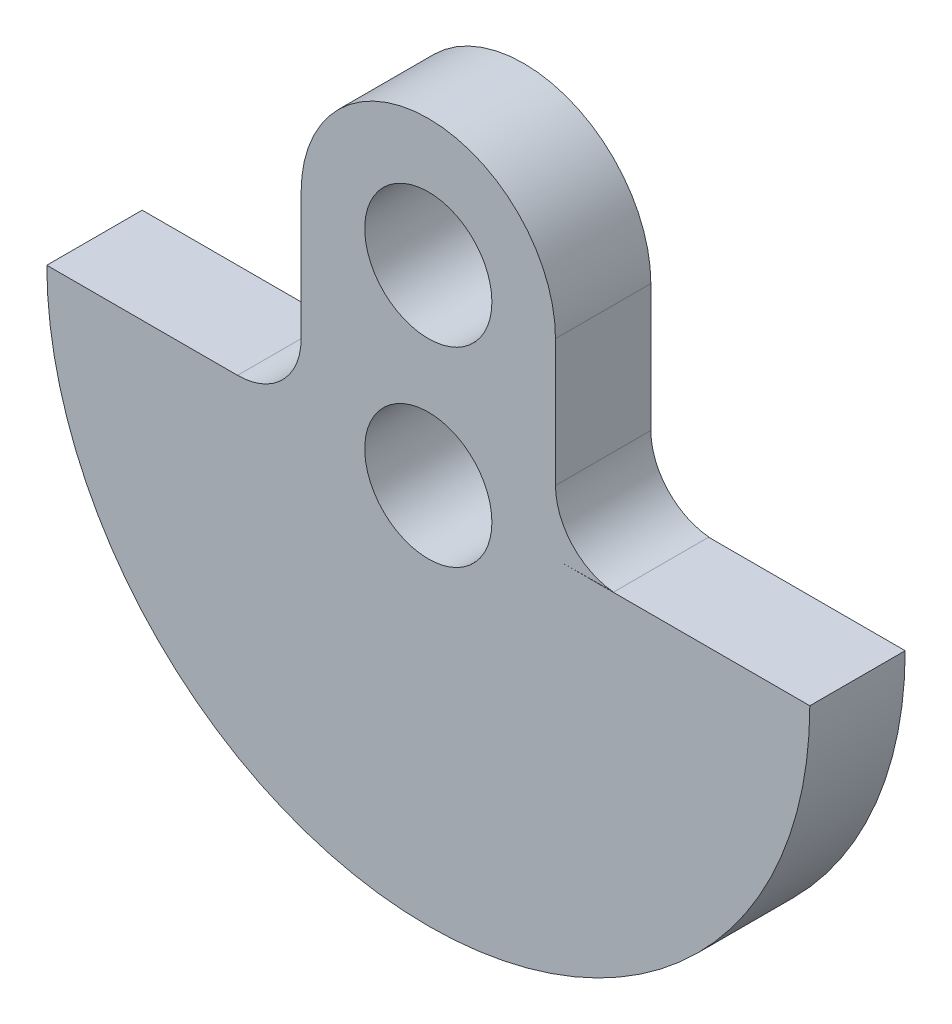
from build123d import *

# Parameters (mm, degrees)
BOSS_EXTRUDE1_DEPTH = 15
BOSS_EXTRUDE2_DEPTH = 15
BOSS_EXTRUDE4_DEPTH = 15
BOSS_EXTRUDE5_DEPTH = 15
SKETCH7_R           = 10
CUT_EXTRUDE1_DEPTH  = 15
SKETCH8_R           = 10
CUT_EXTRUDE2_DEPTH  = 15


with BuildPart() as part:
    # Sketch2 → Boss-Extrude1 (new body)
    with BuildSketch(Plane.XY):
        with BuildLine():
            Line((-60, 0), (60, 0))
            ThreePointArc((60, 0), (0, -60), (-60, 0))
        make_face()
    extrude(amount=BOSS_EXTRUDE1_DEPTH)

    # Sketch3 → Boss-Extrude2 (add)
    with BuildSketch(Plane.XY.offset(15)):
        with BuildLine():
            Line((-20, 30), (-20, 0))
            Line((-20, 0), (20, 0))
            Line((20, 0), (20, 30))
            ThreePointArc((20, 30), (0, 50), (-20, 30))
        make_face()
    extrude(amount=-BOSS_EXTRUDE2_DEPTH)

    # Sketch4 → Boss-Extrude4 (add)
    with BuildSketch(Plane.XY.offset(15)):
        with BuildLine():
            Line((20, 10), (20, 0))
            Line((20, 0), (29.123112456, 0.038520781))
            ThreePointArc((29.123112456, 0.038520781), (22.625419488, 3.246070605), (20, 10))
        make_face()
    extrude(amount=-BOSS_EXTRUDE4_DEPTH)

    # Sketch6 → Boss-Extrude5 (add)
    with BuildSketch(Plane.XY.offset(15)):
        with BuildLine():
            Line((-20, 10), (-20, 0))
            Line((-20, 0), (-30, 0))
            ThreePointArc((-30, 0), (-22.928932188, 2.928932188), (-20, 10))
        make_face()
    extrude(amount=-BOSS_EXTRUDE5_DEPTH)

    # Sketch7 → Cut-Extrude1 (cut)
    with BuildSketch(Plane.XY.offset(15)):
        with Locations((0, 30)):
            Circle(SKETCH7_R)
    extrude(amount=-CUT_EXTRUDE1_DEPTH, mode=Mode.SUBTRACT)

    # Sketch8 → Cut-Extrude2 (cut)
    with BuildSketch(Plane.XY.offset(15)):
        Circle(SKETCH8_R)
    extrude(amount=-CUT_EXTRUDE2_DEPTH, mode=Mode.SUBTRACT)


solid = part.part
